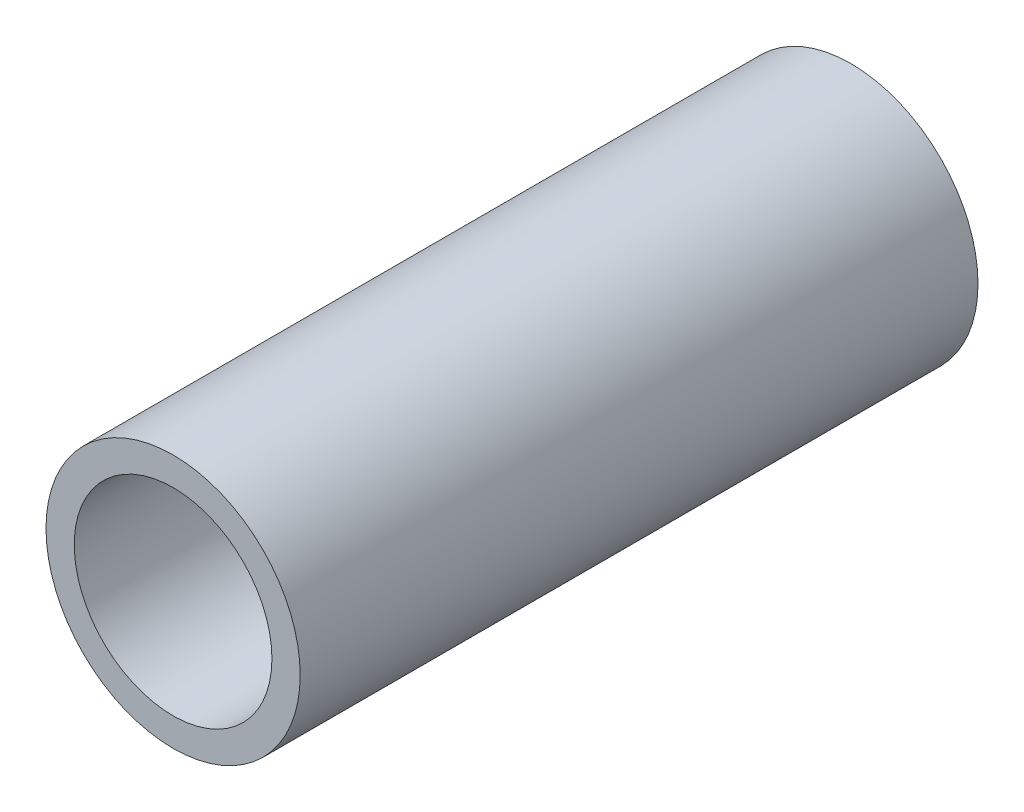
from build123d import *

# Parameters (mm, degrees)
SKETCH1_R           = 9
SKETCH1_R_2         = 7
BOSS_EXTRUDE1_DEPTH = 48


with BuildPart() as part:
    # Sketch1 → Boss-Extrude1 (new body)
    with BuildSketch(Plane.XY):
        Circle(SKETCH1_R)
        Circle(SKETCH1_R_2, mode=Mode.SUBTRACT)
    extrude(amount=BOSS_EXTRUDE1_DEPTH)


solid = part.part
